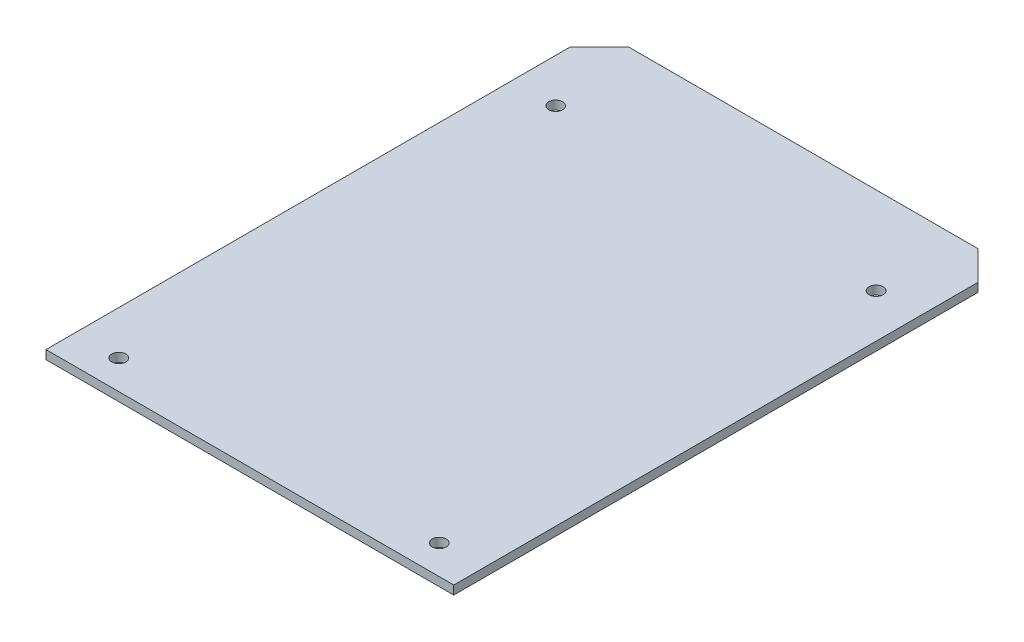
from build123d import *

# Parameters (mm, degrees)
SKETCH1_W            = 140
SKETCH1_H            = 190
BOSS_EXTRUDE1_DEPTH  = 3
M4_CLEARANCE_HOLE1_D = 4.8
CHAMFER1_SIZE        = 10


with BuildPart() as part:
    # Sketch1 → Boss-Extrude1 (new body)
    with BuildSketch(Plane(origin=(0, 0, 0), x_dir=(1, 0, 0), z_dir=(0, 1, 0))):
        Rectangle(SKETCH1_W, SKETCH1_H)
    extrude(amount=BOSS_EXTRUDE1_DEPTH)

    # M4 Clearance Hole1 (through all)
    with Locations(Plane(origin=(0, 3, 0), x_dir=(1, 0, 0), z_dir=(0, 1, 0))):
        with Locations((-55, -85), (55, -85), (-55, 65), (55, 65)):
            Hole(M4_CLEARANCE_HOLE1_D / 2)

    # Chamfer1
    chamfer1_edges = [part.edges().sort_by_distance(p)[0] for p in [
        (-70, 1.5, -95),
        (70, 1.5, -95),
    ]]
    chamfer(chamfer1_edges, length=CHAMFER1_SIZE)


solid = part.part
